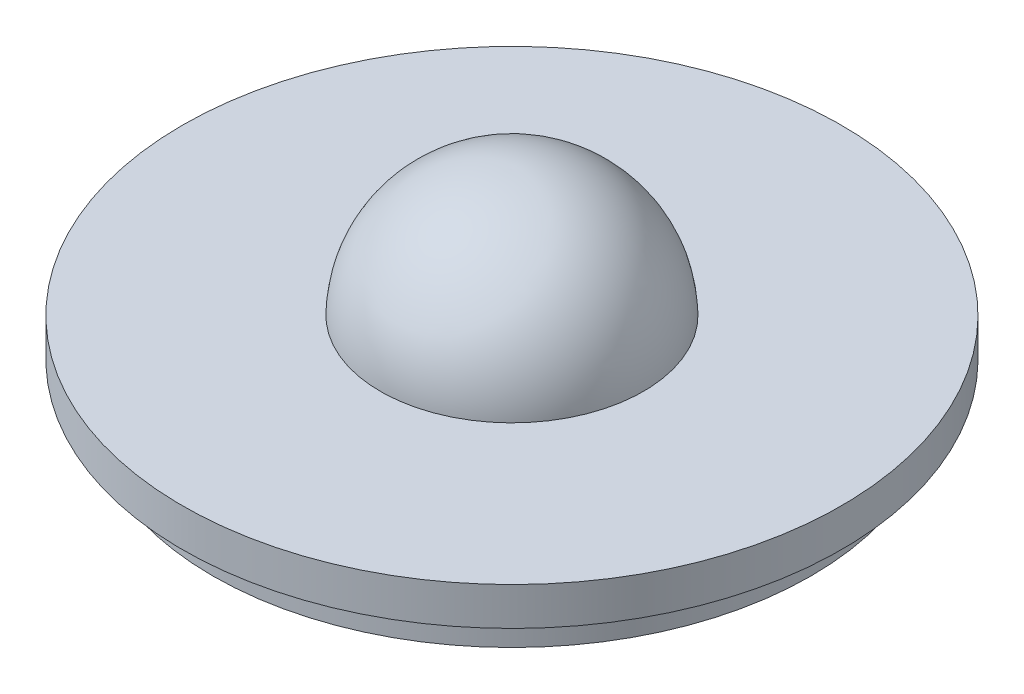
from build123d import *


with BuildPart() as part:
    # Croquis1 → Revolución1 (revolve)
    with BuildSketch(Plane.XY):
        with BuildLine():
            Line((-27.691646337, -4.777448071), (-27.691646337, -1.777448071))
            Line((-27.691646337, -1.777448071), (-4.991646337, -1.777448071))
            Line((-4.991646337, -1.777448071), (-4.991646337, 11.222551929))
            ThreePointArc((-4.991646337, 11.222551929), (-12.252224974, 8.372117695), (-15.370667987, 1.222551929))
            Line((-15.370667987, 1.222551929), (-30.991646337, 1.222551929))
            Line((-30.991646337, 1.222551929), (-30.991646337, -1.777448071))
            Line((-30.991646337, -1.777448071), (-28.591646337, -1.777448071))
            Line((-28.591646337, -1.777448071), (-28.591646337, -4.777448071))
            Line((-28.591646337, -4.777448071), (-27.691646337, -4.777448071))
        make_face()
    revolve(axis=Axis((-4.991646337, 5.975396892, 0), (0, -1, 0)))


solid = part.part
